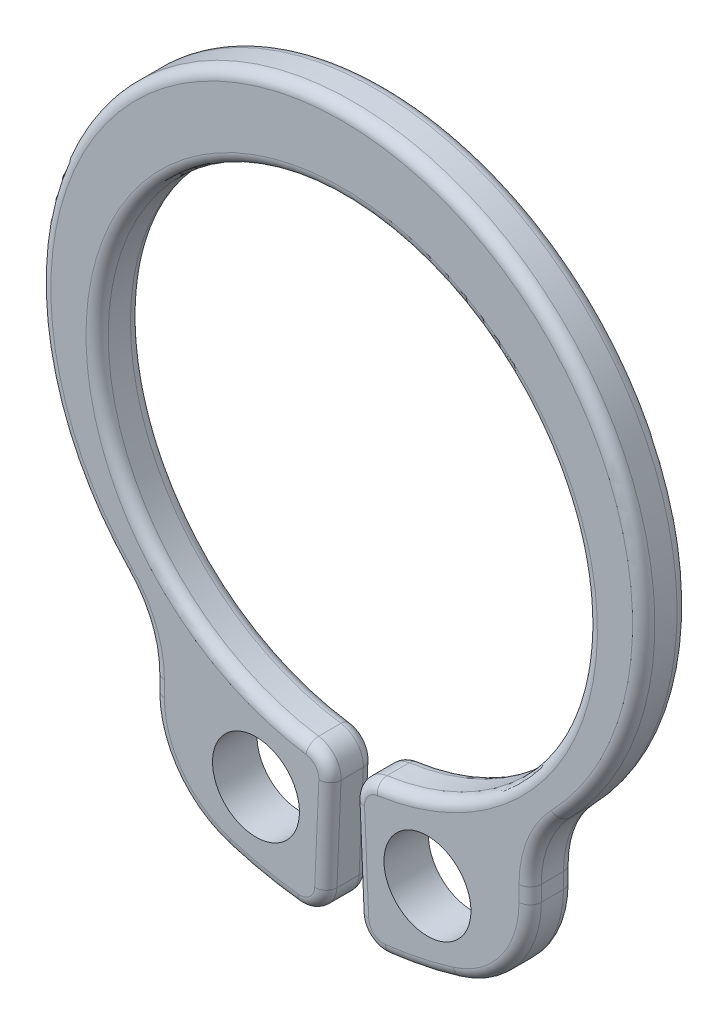
from build123d import *

# Parameters (mm, degrees)
SKETCH2_R           = 0.9775
BOSS_EXTRUDE1_DEPTH = 0.5
FILLET1_R           = 2.345231598
FILLET2_R           = 0.586307899
FILLET3_R           = 0.25


with BuildPart() as part:
    # Sketch2 → Boss-Extrude1 (new, symmetric)
    with BuildSketch(Plane.XY):
        with BuildLine():
            Line((-4.238441776, -7.721608218), (-4.235611145, -4.797874345))
            ThreePointArc((-4.235611145, -4.797874345), (-6.4089579, 2.753446809), (0, 7.3))
            Line((0, 7.3), (0, 5.5))
            ThreePointArc((0, 5.5), (-5.498691149, 0.119981868), (-0.239906631, -5.494765219))
            Line((-0.239906631, -5.494765219), (-0.384216298, -8.8))
            ThreePointArc((-0.384216298, -8.8), (-2.373388743, -8.482608563), (-4.238441776, -7.721608218))
        make_face()
        with Locations((-1.927672435, -6.889596469)):
            Circle(SKETCH2_R, mode=Mode.SUBTRACT)
    extrude(amount=BOSS_EXTRUDE1_DEPTH, both=True)

    # Fillet1
    fillet1_edges = [part.edges().sort_by_distance(p)[0] for p in [
        (-4.238441776, -7.721608218, 0),
        (-4.235611145, -4.797874345, 0),
    ]]
    fillet(fillet1_edges, radius=FILLET1_R)

    # Fillet2
    fillet2_edges = [part.edges().sort_by_distance(p)[0] for p in [
        (-0.239906631, -5.494765219, 0),
        (-0.384216298, -8.8, 0),
    ]]
    fillet(fillet2_edges, radius=FILLET2_R)

    # Mirror1: part across plane


with BuildPart() as part_1:
    add(part.part)
    add(part.part.mirror(Plane(origin=(0, 7.3, 0.5), x_dir=(0, 0, 1), z_dir=(-1, 0, 0))))

    # Fillet3
    fillet3_edges = [part_1.edges().sort_by_distance(p)[0] for p in [
        (-1.801911763, -8.622107408, -0.5),
        (-1.801911763, -8.622107408, 0.5),
        (-4.236777929, -6.003035614, -0.5),
        (-3.777856114, -7.573876592, -0.5),
        (-4.236777929, -6.003035614, 0.5),
        (-3.777856114, -7.573876592, 0.5),
        (-4.406247452, -4.950227612, -0.5),
        (-4.406247452, -4.950227612, 0.5),
        (-0.310987617, -7.122787459, -0.5),
        (-0.310987617, -7.122787459, 0.5),
        (0, 5.5, -0.5),
        (-0.399126544, -5.651863663, -0.5),
        (-0.563049305, -8.61389272, -0.5),
        (5.486508349, 0.385001482, 0.5),
        (-0.399126544, -5.651863663, 0.5),
        (6.248463616, 3.167848868, 0.5),
        (-0.563049305, -8.61389272, 0.5),
        (0.310987617, -7.122787459, -0.5),
        (4.236777929, -6.003035614, -0.5),
        (1.801911763, -8.622107408, -0.5),
        (4.236777929, -6.003035614, 0.5),
        (1.801911763, -8.622107408, 0.5),
        (0.310987617, -7.122787459, 0.5),
        (3.777856114, -7.573876592, 0.5),
        (3.777856114, -7.573876592, -0.5),
        (4.406247452, -4.950227612, 0.5),
        (4.406247452, -4.950227612, -0.5),
        (0.563049305, -8.61389272, 0.5),
        (0.563049305, -8.61389272, -0.5),
        (0.399126544, -5.651863663, 0.5),
        (0.399126544, -5.651863663, -0.5),
        (6.248463616, 3.167848868, -0.5),
    ]]
    fillet(fillet3_edges, radius=FILLET3_R)


solid = part_1.part
